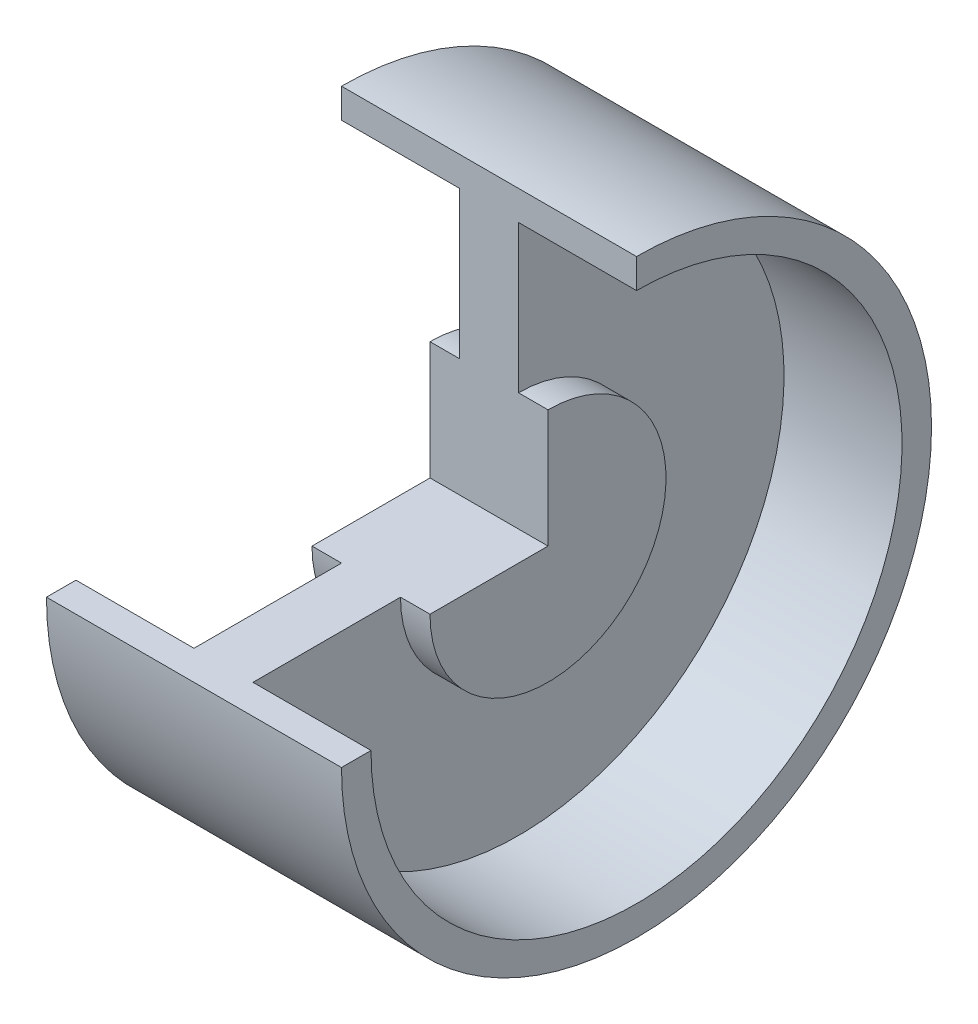
from build123d import *

# Parameters (mm, degrees)
REVOLVE1_ANGLE = 270


with BuildPart() as part:
    # Sketch3 → Revolve1 (revolve)
    with BuildSketch(Plane.XY):
        Polygon((10, 0), (-10, 0), (-10, 20), (-5, 20), (-5, 45), (-25, 45), (-25, 50), (-5, 50), (5, 50), (25, 50), (25, 45), (5, 45), (5, 20), (10, 20), align=None)
    revolve(axis=Axis((10, 0, 0), (-1, 0, 0)), revolution_arc=REVOLVE1_ANGLE)


solid = part.part
